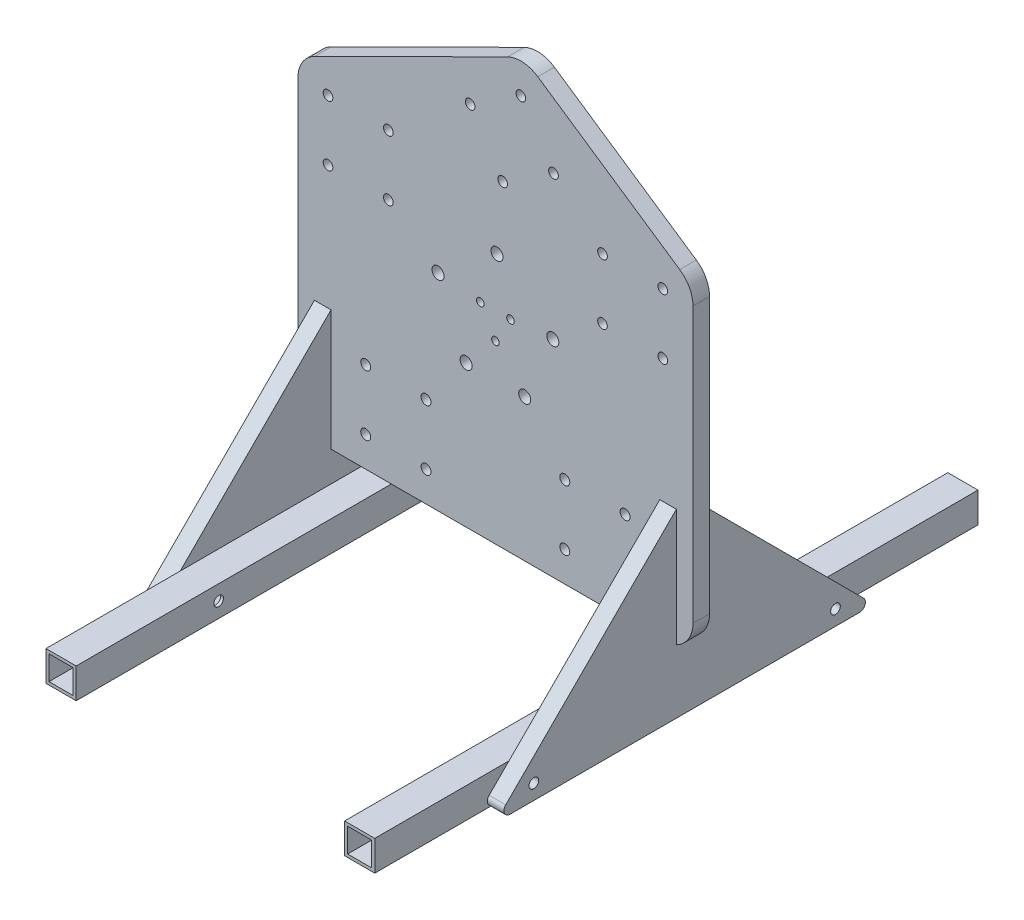
from build123d import *

# Parameters (mm, degrees)
SKETCH_2_R           = 1.65
SKETCH_2_R_2         = 1.6
SKETCH_2_R_3         = 2
SKETCH_2_R_4         = 1.25
EXTRUDE_1_DEPTH      = 5.5
SKETCH_4_R           = 24.5
SKETCH_4_R_2         = 1.7
SKETCH_4_R_3         = 1.6
EXTRUDE_2_DEPTH      = 10
SKETCH_6_W           = 5.5
SKETCH_6_H           = 20
CUT_EXTRUDE_1_DEPTH  = 114.127512901
EXTRUDE_3_DEPTH      = 5.5
FILLET_1_R           = 2
EXTRUDE_4_DEPTH      = 100
EXTRUDE_4_DEPTH_BACK = 100
SKETCH_8_W           = 10
SKETCH_8_H           = 10
SKETCH_8_W_2         = 8
SKETCH_8_H_2         = 8
SKETCH_9_R           = 1.6
CUT_EXTRUDE_2_DEPTH  = 185.438564772


with BuildPart() as part:
    # ｽｹｯﾁ2 → ﾎﾞｽ - 押し出し1 (new body)
    with BuildSketch(Plane.XY):
        with BuildLine():
            Line((-65.5, 49.093386622), (-65.5, -42))
            ThreePointArc((-65.5, -42), (-62.571067812, -49.071067812), (-55.5, -52))
            Line((-55.5, -52), (55.5, -52))
            ThreePointArc((55.5, -52), (62.571067812, -49.071067812), (65.5, -42))
            Line((65.5, -42), (65.5, 49.093386622))
            ThreePointArc((65.5, 49.093386622), (64.332789665, 53.781864705), (61.103634655, 57.375854772))
            Line((61.103634655, 57.375854772), (14.055002247, 89.207350196))
            ThreePointArc((14.055002247, 89.207350196), (9.115789336, 90.902784819), (3.995386471, 89.877213153))
            Line((3.995386471, 89.877213153), (-59.955981121, 58.045717729))
            ThreePointArc((-59.955981121, 58.045717729), (-64.001758971, 54.358374219), (-65.5, 49.093386622))
        make_face()
        with Locations((-43, -42)):
            Circle(SKETCH_2_R, mode=Mode.SUBTRACT)
        with Locations((-43, -22)):
            Circle(SKETCH_2_R, mode=Mode.SUBTRACT)
        with Locations((-23, -22)):
            Circle(SKETCH_2_R, mode=Mode.SUBTRACT)
        with Locations((-23, -42)):
            Circle(SKETCH_2_R, mode=Mode.SUBTRACT)
        with Locations(Location((23, -42, 0), (0, 0, 180))):
            Circle(SKETCH_2_R, mode=Mode.SUBTRACT)
        with Locations(Location((23, -22, 0), (0, 0, 180))):
            Circle(SKETCH_2_R, mode=Mode.SUBTRACT)
        with Locations(Location((43, -22, 0), (0, 0, 180))):
            Circle(SKETCH_2_R, mode=Mode.SUBTRACT)
        with Locations(Location((43, -42, 0), (0, 0, 180))):
            Circle(SKETCH_2_R, mode=Mode.SUBTRACT)
        with Locations((-55.5, 49.093386622)):
            Circle(SKETCH_2_R_2, mode=Mode.SUBTRACT)
        with Locations((-55.5, 29.093386622)):
            Circle(SKETCH_2_R_2, mode=Mode.SUBTRACT)
        with Locations((-35.5, 29.093386622)):
            Circle(SKETCH_2_R_2, mode=Mode.SUBTRACT)
        with Locations((-35.5, 49.093386622)):
            Circle(SKETCH_2_R_2, mode=Mode.SUBTRACT)
        with Locations(Location((35.5, 49.093386622, 0), (0, 0, 180))):
            Circle(SKETCH_2_R_2, mode=Mode.SUBTRACT)
        with Locations(Location((35.5, 29.093386622, 0), (0, 0, 180))):
            Circle(SKETCH_2_R_2, mode=Mode.SUBTRACT)
        with Locations(Location((55.5, 29.093386622, 0), (0, 0, 180))):
            Circle(SKETCH_2_R_2, mode=Mode.SUBTRACT)
        with Locations(Location((55.5, 49.093386622, 0), (0, 0, 180))):
            Circle(SKETCH_2_R_2, mode=Mode.SUBTRACT)
        with Locations((8.451367593, 80.924882046)):
            Circle(SKETCH_2_R_2, mode=Mode.SUBTRACT)
        with Locations((-8.379934091, 70.121767512)):
            Circle(SKETCH_2_R_2, mode=Mode.SUBTRACT)
        with Locations((2.423180443, 53.290465828)):
            Circle(SKETCH_2_R_2, mode=Mode.SUBTRACT)
        with Locations((19.254482127, 64.093580363)):
            Circle(SKETCH_2_R_2, mode=Mode.SUBTRACT)
        with Locations((-19.026619177, 16.363955986)):
            Circle(SKETCH_2_R_3, mode=Mode.SUBTRACT)
        with Locations((0.524315172, 31.586336466)):
            Circle(SKETCH_2_R_3, mode=Mode.SUBTRACT)
        with Locations((19.026619177, 16.363955986)):
            Circle(SKETCH_2_R_3, mode=Mode.SUBTRACT)
        with Locations((9.718542636, -4.812231646)):
            Circle(SKETCH_2_R_3, mode=Mode.SUBTRACT)
        with Locations((-9.718542636, -4.812231646)):
            Circle(SKETCH_2_R_3, mode=Mode.SUBTRACT)
        with Locations((0, 6.319883931)):
            Circle(SKETCH_2_R_4, mode=Mode.SUBTRACT)
        with Locations((-5, 14.980137968)):
            Circle(SKETCH_2_R_4, mode=Mode.SUBTRACT)
        with Locations((5, 14.980137968)):
            Circle(SKETCH_2_R_4, mode=Mode.SUBTRACT)
    extrude(amount=EXTRUDE_1_DEPTH)

    # ｽｹｯﾁ6 → ｶｯﾄ - 押し出し1 (cut, through all)
    with BuildSketch(Plane.XY.offset(5.5)):
        with Locations((57.25, -42)):
            Rectangle(SKETCH_6_W, SKETCH_6_H)
        with Locations((-57.25, -42)):
            Rectangle(SKETCH_6_W, SKETCH_6_H)
    extrude(amount=-CUT_EXTRUDE_1_DEPTH, mode=Mode.SUBTRACT)


with BuildPart() as body_2:
    # ｽｹｯﾁ4 → ﾎﾞｽ - 押し出し2 (new body)
    with BuildSketch(Plane(origin=(0, 0, 0), x_dir=(-1, 0, 0), z_dir=(0, 0, -1))):
        with Locations((0, 12.093386622)):
            Circle(SKETCH_4_R)
        with Locations((-0.524315172, 31.586336466)):
            Circle(SKETCH_4_R_2, mode=Mode.SUBTRACT)
        with Locations((-19.026619177, 16.363955986)):
            Circle(SKETCH_4_R_2, mode=Mode.SUBTRACT)
        with Locations((19.026619177, 16.363955986)):
            Circle(SKETCH_4_R_2, mode=Mode.SUBTRACT)
        with Locations((9.718542636, -4.812231646)):
            Circle(SKETCH_4_R_2, mode=Mode.SUBTRACT)
        with Locations((-9.718542636, -4.812231646)):
            Circle(SKETCH_4_R_2, mode=Mode.SUBTRACT)
        with Locations((0, 6.319883931)):
            Circle(SKETCH_4_R_3, mode=Mode.SUBTRACT)
        with Locations((-5, 14.980137968)):
            Circle(SKETCH_4_R_3, mode=Mode.SUBTRACT)
        with Locations((5, 14.980137968)):
            Circle(SKETCH_4_R_3, mode=Mode.SUBTRACT)
    extrude(amount=EXTRUDE_2_DEPTH)


with BuildPart() as body_3:
    # ｽｹｯﾁ7 → ﾎﾞｽ - 押し出し3 (new body)
    with BuildSketch(Plane.ZY.offset(-60)):
        Polygon((0, -32), (5.5, -32), (5.5, -12), (65.5, -72), (-60, -72), (0, -12), align=None)
    extrude(amount=EXTRUDE_3_DEPTH)

    # ﾌｨﾚｯﾄ1
    fillet_1_edges = [body_3.edges().sort_by_distance(p)[0] for p in [
        (57.25, -72, 65.5),
        (57.25, -72, -60),
    ]]
    fillet(fillet_1_edges, radius=FILLET_1_R)


with BuildPart() as body_4:
    # ﾐﾗｰ1: mirrored copy
    add(body_3.part.mirror(Plane(origin=(0, 0, 0), x_dir=(0, 0, 1), z_dir=(1, 0, 0))))


with BuildPart() as body_5:
    # ｽｹｯﾁ8 → ﾎﾞｽ - 押し出し4 (new, two sides: drawn at the far end of the back side and taken through both)
    with BuildSketch(Plane.XY.offset(-EXTRUDE_4_DEPTH_BACK)):
        with Locations((-49.5, -67)):
            Rectangle(SKETCH_8_W, SKETCH_8_H)
        with Locations((-49.5, -67)):
            Rectangle(SKETCH_8_W_2, SKETCH_8_H_2, mode=Mode.SUBTRACT)
    extrude(amount=EXTRUDE_4_DEPTH + EXTRUDE_4_DEPTH_BACK)


with BuildPart() as body_6:
    # ﾐﾗｰ2: mirrored copy
    add(body_5.part.mirror(Plane(origin=(0, 0, 0), x_dir=(0, 0, 1), z_dir=(1, 0, 0))))


with BuildPart() as cut_extrude_2_tool:
    # ｽｹｯﾁ9 → ｶｯﾄ - 押し出し2 (new, through all)
    with BuildSketch(Plane(origin=(60, 0, 0), x_dir=(0, 0, -1), z_dir=(1, 0, 0))):
        with Locations(Location((47.25, -67, 0), (0, 0, 180))):
            Circle(SKETCH_9_R)
        with Locations(Location((-52.75, -67, 0), (0, 0, 180))):
            Circle(SKETCH_9_R)
    extrude(amount=-CUT_EXTRUDE_2_DEPTH)


with BuildPart() as body_3_1:
    add(body_3.part)

    # ｶｯﾄ - 押し出し2: cut by cut_extrude_2_tool
    add(cut_extrude_2_tool.part, mode=Mode.SUBTRACT)


with BuildPart() as body_4_1:
    add(body_4.part)

    # ｶｯﾄ - 押し出し2: cut by cut_extrude_2_tool
    add(cut_extrude_2_tool.part, mode=Mode.SUBTRACT)


with BuildPart() as body_5_1:
    add(body_5.part)

    # ｶｯﾄ - 押し出し2: cut by cut_extrude_2_tool
    add(cut_extrude_2_tool.part, mode=Mode.SUBTRACT)


with BuildPart() as body_6_1:
    add(body_6.part)

    # ｶｯﾄ - 押し出し2: cut by cut_extrude_2_tool
    add(cut_extrude_2_tool.part, mode=Mode.SUBTRACT)


solid = Compound([part.part, body_2.part, body_3_1.part, body_4_1.part, body_5_1.part, body_6_1.part])
